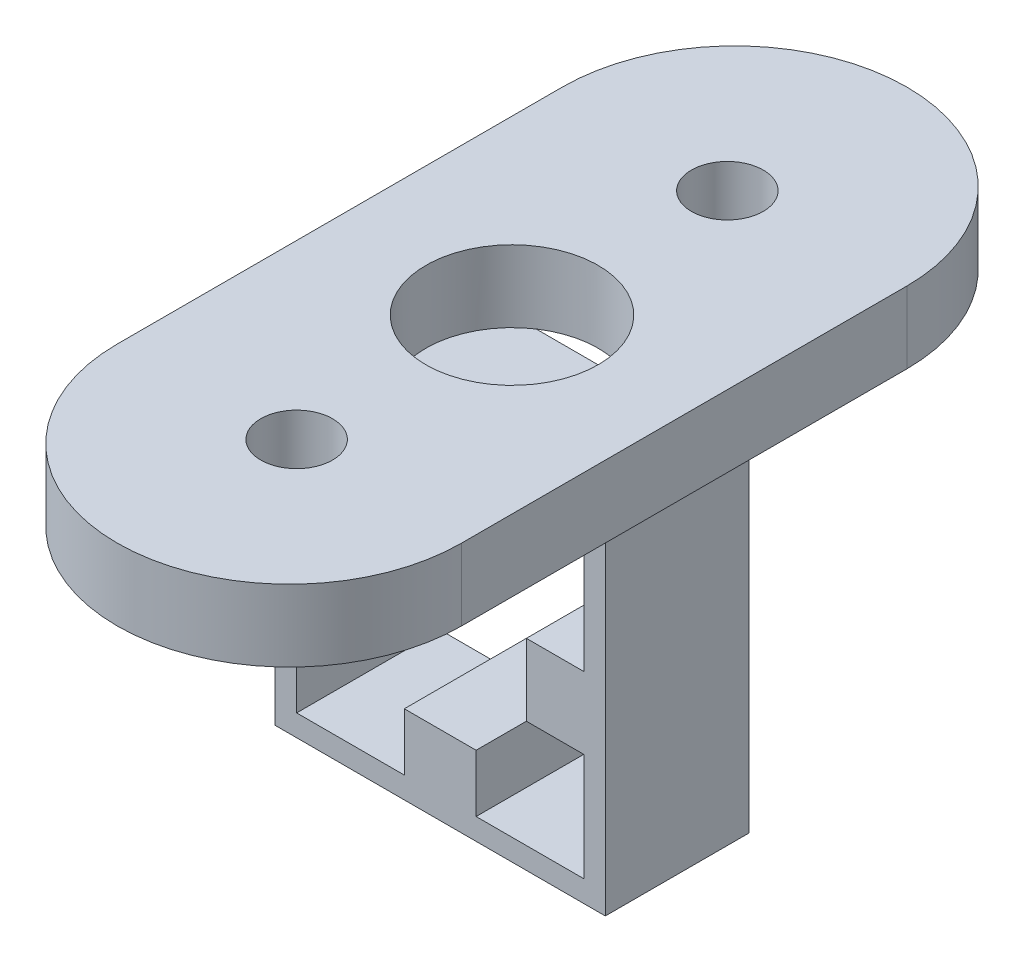
from build123d import *

# Parameters (mm, degrees)
SKETCH1_W           = 23
SKETCH1_H           = 23
BOSS_EXTRUDE1_DEPTH = 10
SKETCH2_R           = 2.5
SKETCH2_R_2         = 6
BOSS_EXTRUDE2_DEPTH = 5


with BuildPart() as part:
    # Sketch1 → Boss-Extrude1 (new body)
    with BuildSketch(Plane.XY):
        Rectangle(SKETCH1_W, SKETCH1_H)
        Polygon((-2.5, 10), (-10, 10), (-10, 2.5), (-6, 2.5), (-6, -2.5), (-10, -2.5), (-10, -10), (-2.5, -10), (-2.5, -6), (2.5, -6), (2.5, -10), (10, -10), (10, -2.5), (6, -2.5), (6, 2.5), (10, 2.5), (10, 10), (2.5, 10), (2.5, 6), (-2.5, 6), align=None, mode=Mode.SUBTRACT)
    extrude(amount=BOSS_EXTRUDE1_DEPTH)

    # Sketch2 → Boss-Extrude2 (add)
    with BuildSketch(Plane(origin=(0, 11.5, 0), x_dir=(1, 0, 0), z_dir=(0, 1, 0))):
        with BuildLine():
            Line((-12, -20.506265624), (-12, 10.506265624))
            ThreePointArc((-12, 10.506265624), (0, 22.506265624), (12, 10.506265624))
            Line((12, 10.506265624), (12, -20.506265624))
            ThreePointArc((12, -20.506265624), (0, -32.506265624), (-12, -20.506265624))
        make_face()
        with Locations(Location((0, 10, 0), (0, 0, 270))):
            Circle(SKETCH2_R, mode=Mode.SUBTRACT)
        with Locations(Location((0, -20, 0), (0, 0, 90))):
            Circle(SKETCH2_R, mode=Mode.SUBTRACT)
        with Locations(Location((0, -5, 0), (0, 0, 56.442690238))):
            Circle(SKETCH2_R_2, mode=Mode.SUBTRACT)
    extrude(amount=BOSS_EXTRUDE2_DEPTH)


solid = part.part
